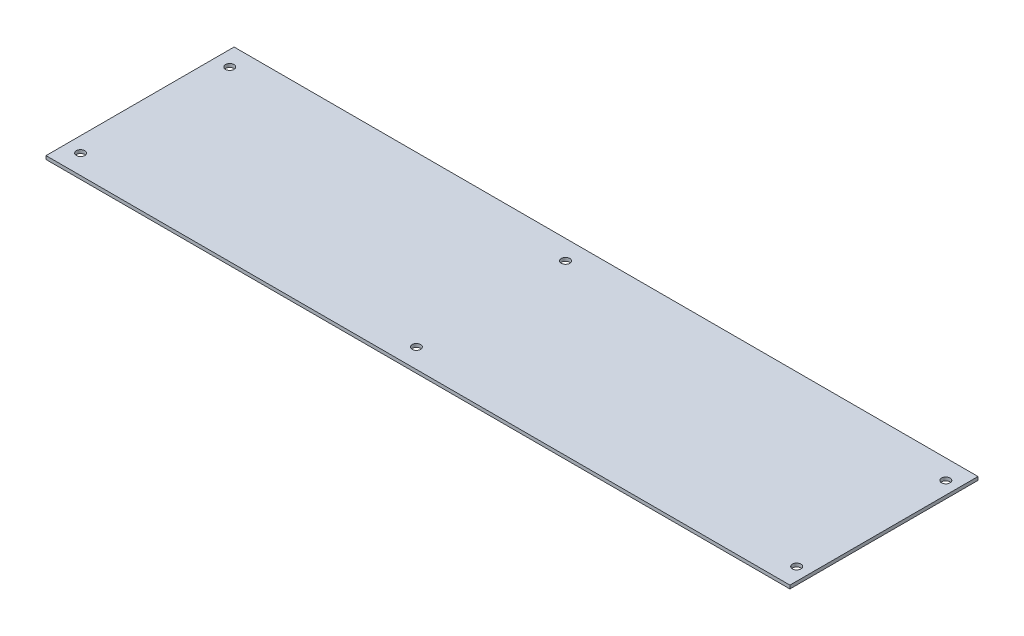
from build123d import *

# Parameters (mm, degrees)
SKETCH1_W               = 696.9125
SKETCH1_H               = 176.2125
BOSS_EXTRUDE1_DEPTH     = 3.175
CUT_EXTRUDE1_DEPTH      = 384.558251102
CUT_EXTRUDE1_DEPTH_BACK = 384.558251102
SKETCH2_R               = 3.96875


with BuildPart() as part:
    # Sketch1 → Boss-Extrude1 (new body)
    with BuildSketch(Plane(origin=(0, 0, 0), x_dir=(1, 0, 0), z_dir=(0, 1, 0))):
        with Locations((348.45625, -88.10625)):
            Rectangle(SKETCH1_W, SKETCH1_H)
    extrude(amount=BOSS_EXTRUDE1_DEPTH)

    # Sketch2 → Cut-Extrude1 (cut, two sides: drawn at the far end of the back side and taken through both)
    with BuildSketch(Plane(origin=(324.841503281, 3.175, 83.099532245), x_dir=(1, 0, 0), z_dir=(0, 1, 0)).offset(-CUT_EXTRUDE1_DEPTH_BACK)):
        with Locations(Location((360.164746719, 64.843282245, 0), (0, 0, 270))):
            Circle(SKETCH2_R)
        with Locations(Location((360.164746719, -74.856717755, 0), (0, 0, 270))):
            Circle(SKETCH2_R)
        with Locations(Location((3.908296933, 64.843282245, 0), (0, 0, 270))):
            Circle(SKETCH2_R)
        with Locations(Location((-310.672178196, 64.843282245, 0), (0, 0, 270))):
            Circle(SKETCH2_R)
        with Locations(Location((3.908296933, -74.856717755, 0), (0, 0, 270))):
            Circle(SKETCH2_R)
        with Locations(Location((-310.672178196, -74.856717755, 0), (0, 0, 270))):
            Circle(SKETCH2_R)
    extrude(amount=CUT_EXTRUDE1_DEPTH + CUT_EXTRUDE1_DEPTH_BACK, mode=Mode.SUBTRACT)


solid = part.part
